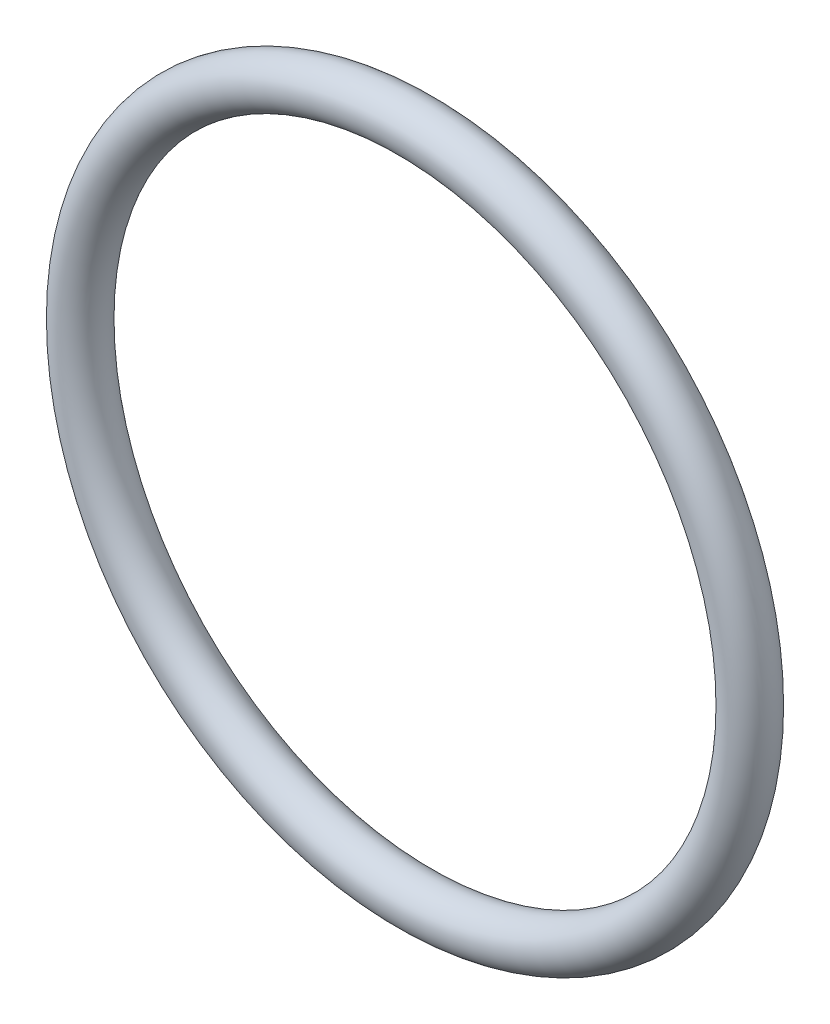
from build123d import *

# Parameters (mm, degrees)
SKETCH1_R = 1.5


with BuildPart() as part:
    # Sketch1 → Revolve1 (revolve)
    with BuildSketch(Plane(origin=(0, 0, 0), x_dir=(0, -1, 0), z_dir=(1, 0, 0)), mode=Mode.PRIVATE) as revolve1_sk:
        with Locations((21, 0)):
            Circle(SKETCH1_R)
    revolve(revolve1_sk.sketch.rotate(Axis((0, 0, 1.5), (0, 0, -1)), 270), axis=Axis((0, 0, 1.5), (0, 0, -1)))


solid = part.part
